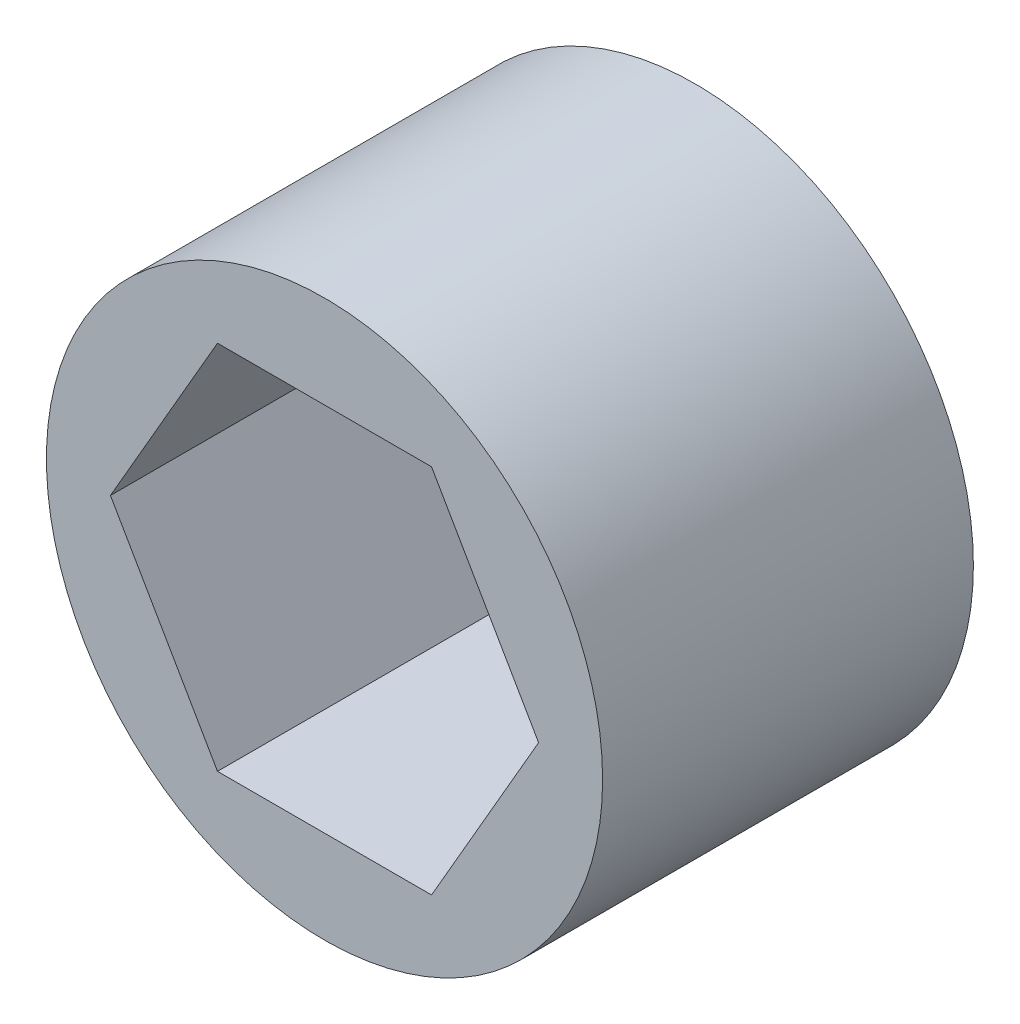
from build123d import *

# Parameters (mm, degrees)
SKETCH1_R           = 9.525
BOSS_EXTRUDE1_DEPTH = 12.7


with BuildPart() as part:
    # Sketch1 → Boss-Extrude1 (new body)
    with BuildSketch(Plane.XY):
        Circle(SKETCH1_R)
        Polygon((-3.666174209, 6.35), (-7.332348419, 0), (-3.666174209, -6.35), (3.666174209, -6.35), (7.332348419, 0), (3.666174209, 6.35), align=None, mode=Mode.SUBTRACT)
    extrude(amount=BOSS_EXTRUDE1_DEPTH)


solid = part.part
